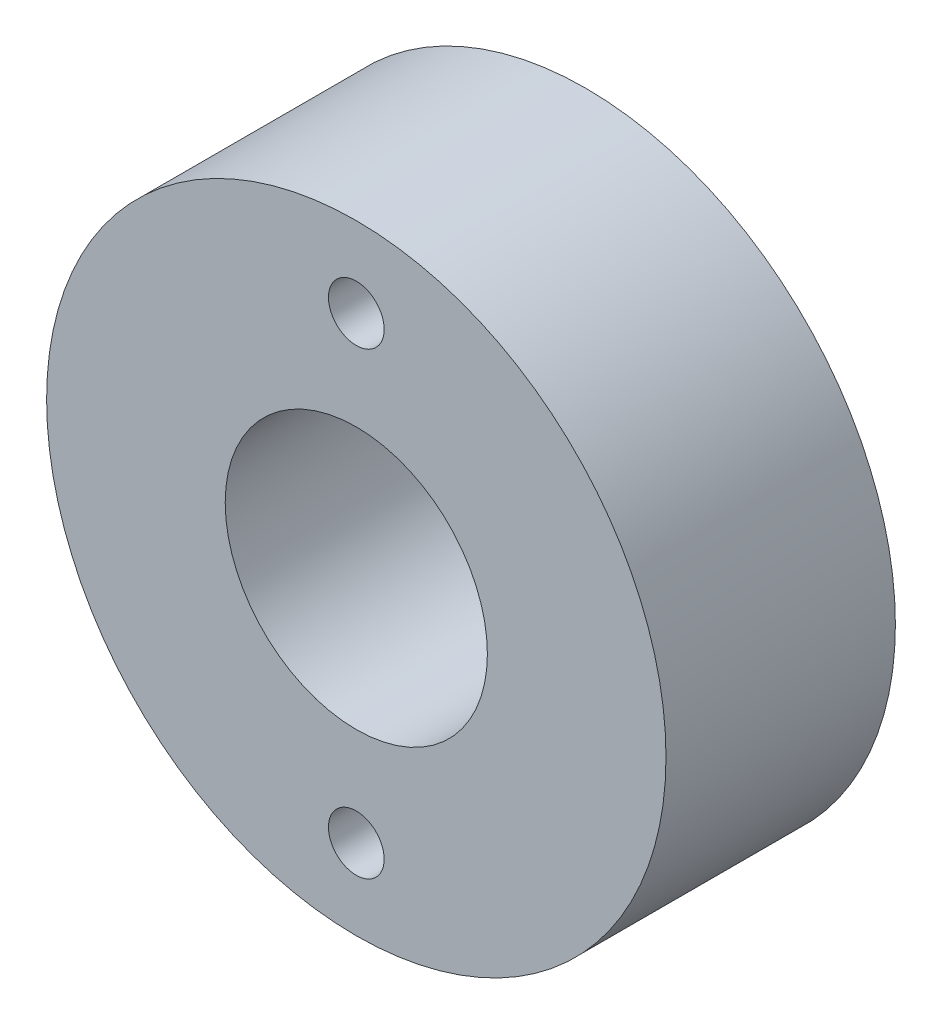
from build123d import *

# Parameters (mm, degrees)
SKETCH1_R                      = 9.45
BOSS_EXTRUDE1_DEPTH            = 7
CUT_EXTRUDE1_REACH             = 17.087
SKETCH2_R                      = 4
TAP_DRILL_FOR_M2_5X0_45_TAP1_D = 1.7


with BuildPart() as part:
    # Sketch1 → Boss-Extrude1 (new body)
    with BuildSketch(Plane.XY):
        Circle(SKETCH1_R)
    extrude(amount=BOSS_EXTRUDE1_DEPTH)

    # Sketch2 → Cut-Extrude1 (cut, up to next)
    with BuildSketch(Plane.XY.offset(7), mode=Mode.PRIVATE) as cut_extrude1_sk1:
        Circle(SKETCH2_R)
    cut_extrude1_tool1 = extrude(cut_extrude1_sk1.sketch, amount=-CUT_EXTRUDE1_REACH, mode=Mode.PRIVATE) & part.part
    add(cut_extrude1_tool1.solids().sort_by_distance((0, 0, 7))[0], mode=Mode.SUBTRACT)

    # Tap Drill for M2.5x0.45 Tap1 (through all)
    with Locations(Plane.XY.offset(7)):
        with Locations((0, 7), (0, -7)):
            Hole(TAP_DRILL_FOR_M2_5X0_45_TAP1_D / 2)


solid = part.part
